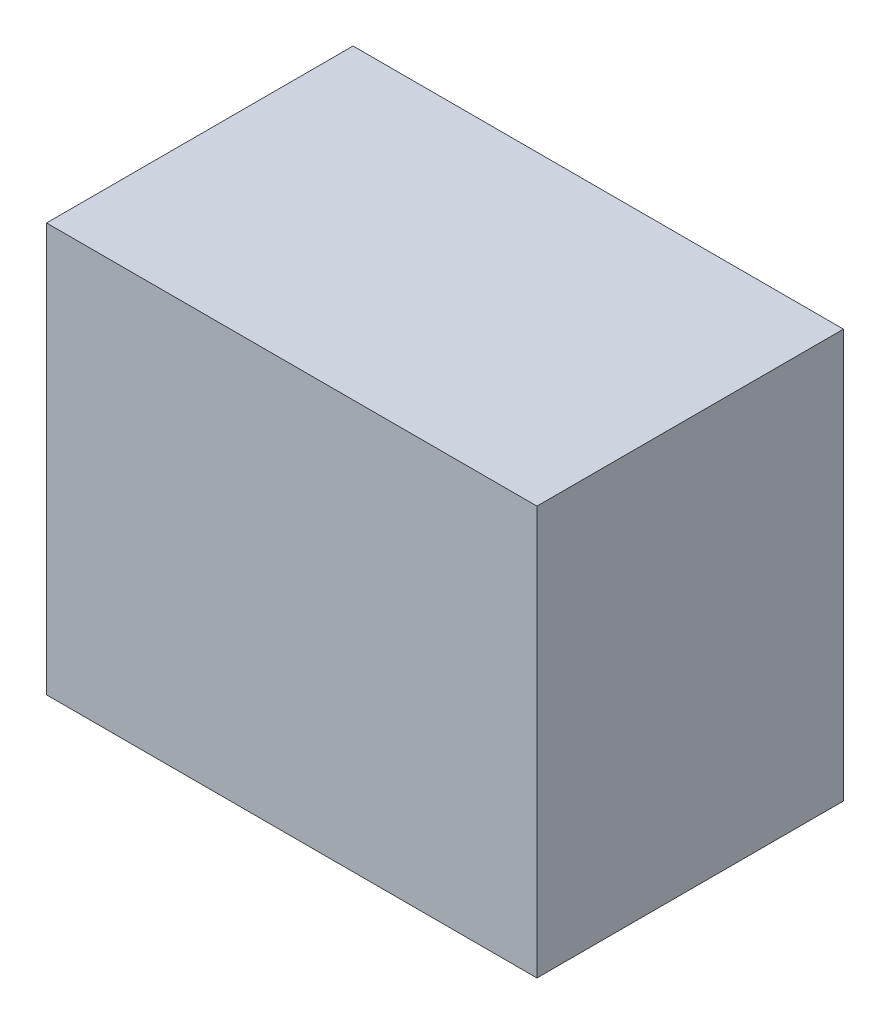
from build123d import *

# Parameters (mm, degrees)
PACK_PANO_PLC_IO_1_START = -173
SKETCH1_W                = 120
SKETCH1_H                = 100
PACK_PANO_PLC_IO_1_DEPTH = 75


with BuildPart() as part:
    # Sketch1 → PACK_pano_plc_IO_1 (new body)
    with BuildSketch(Plane.XY.offset(PACK_PANO_PLC_IO_1_START)):
        with Locations((120, 230)):
            Rectangle(SKETCH1_W, SKETCH1_H)
    extrude(amount=-PACK_PANO_PLC_IO_1_DEPTH)


solid = part.part
